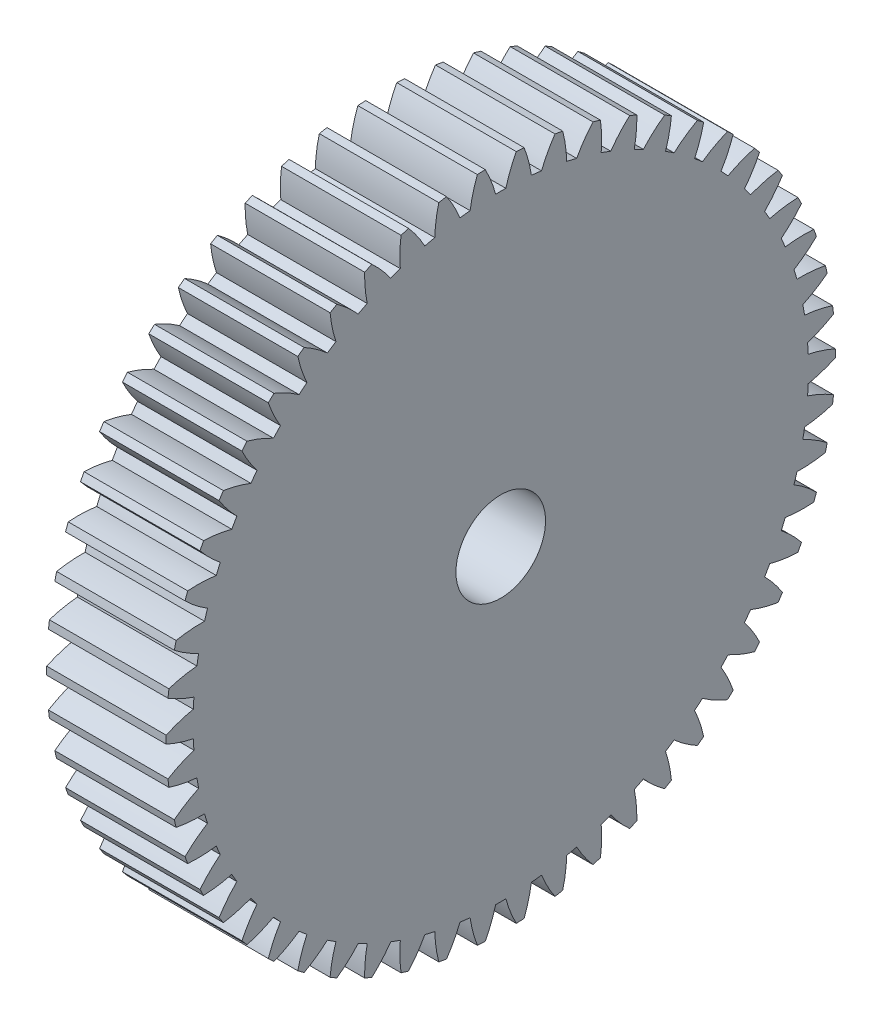
from build123d import *

# Parameters (mm, degrees)
BASPROSKE_W     = 20
BASPROSKE_H     = 56
TOOTHCUT_DEPTH  = 82.682311427
TEETHCUTS_COUNT = 54
TEETHCUTS_ANGLE = 353.333333333
BORSKE_R        = 7.5
BORE_DEPTH      = 50.0000508


with BuildPart() as part:
    # BasProSke → Base-Revolve (revolve)
    with BuildSketch(Plane(origin=(0, 0, 0), x_dir=(1, 0, 0), z_dir=(0, 1, 0)), mode=Mode.PRIVATE) as base_revolve_sk:
        with Locations((10, 28)):
            Rectangle(BASPROSKE_W, BASPROSKE_H)
    revolve(base_revolve_sk.sketch.rotate(Axis((-10, 0, 0), (1, 0, 0)), 180), axis=Axis((-10, 0, 0), (1, 0, 0)))

    # TooCutSke → ToothCut (cut, through all)
    with BuildSketch(Plane(origin=(0, 0, 0), x_dir=(0, 0, -1), z_dir=(1, 0, 0))):
        with BuildLine():
            ThreePointArc((0.853930211, 51.491919795), (0, 51.499), (-0.853930211, 51.491919795))
            ThreePointArc((-0.853930211, 51.491919795), (-1.60941272, 53.777264131), (-2.614474643, 55.964363371))
            ThreePointArc((-2.614474643, 55.964363371), (0, 56.0254), (2.614474643, 55.964363371))
            ThreePointArc((2.614474643, 55.964363371), (1.60941272, 53.777264131), (0.853930211, 51.491919795))
        make_face()
    toothcut = extrude(amount=TOOTHCUT_DEPTH, mode=Mode.SUBTRACT)

    # TeethCuts: ToothCut ×54 about axis
    teethcuts_axis = Axis((-10, 0, 0), (1, 0, 0))
    for i in range(1, TEETHCUTS_COUNT):
        add(toothcut.rotate(teethcuts_axis, i * TEETHCUTS_ANGLE / (TEETHCUTS_COUNT - 1)), mode=Mode.SUBTRACT)

    # BorSke → Bore (cut, symmetric)
    with BuildSketch(Plane(origin=(0, 0, 0), x_dir=(0, 0, -1), z_dir=(1, 0, 0))):
        with Locations(Location((0, 0, 0), (0, 0, 180))):
            Circle(BORSKE_R)
    extrude(amount=BORE_DEPTH, both=True, mode=Mode.SUBTRACT)


solid = part.part
